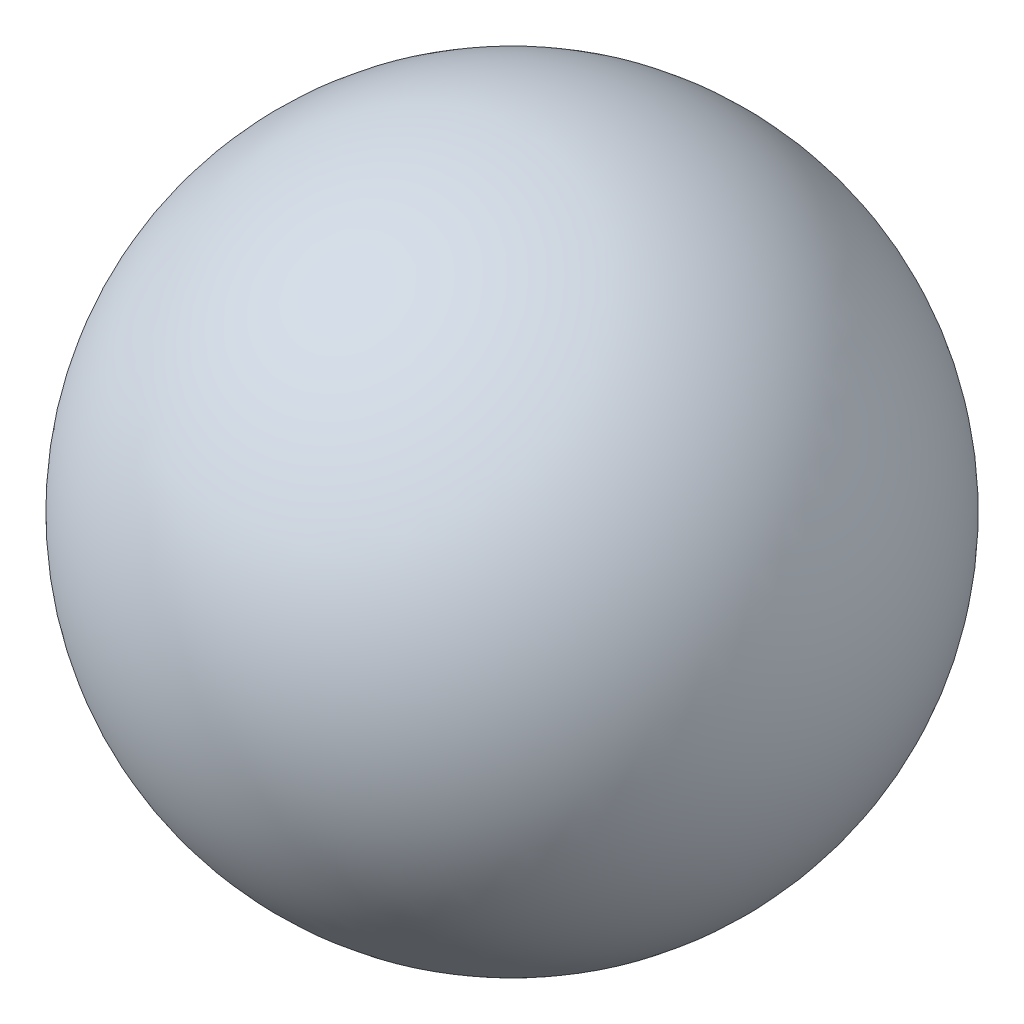
from build123d import *


with BuildPart() as part:
    # Sketch1 → Revolve2 (revolve)
    with BuildSketch(Plane.XY):
        with BuildLine():
            Line((0, 2.75), (0, -2.75))
            ThreePointArc((0, -2.75), (2.75, 0), (0, 2.75))
        make_face()
    revolve(axis=Axis((0, 2.75, 0), (0, -1, 0)))


solid = part.part
